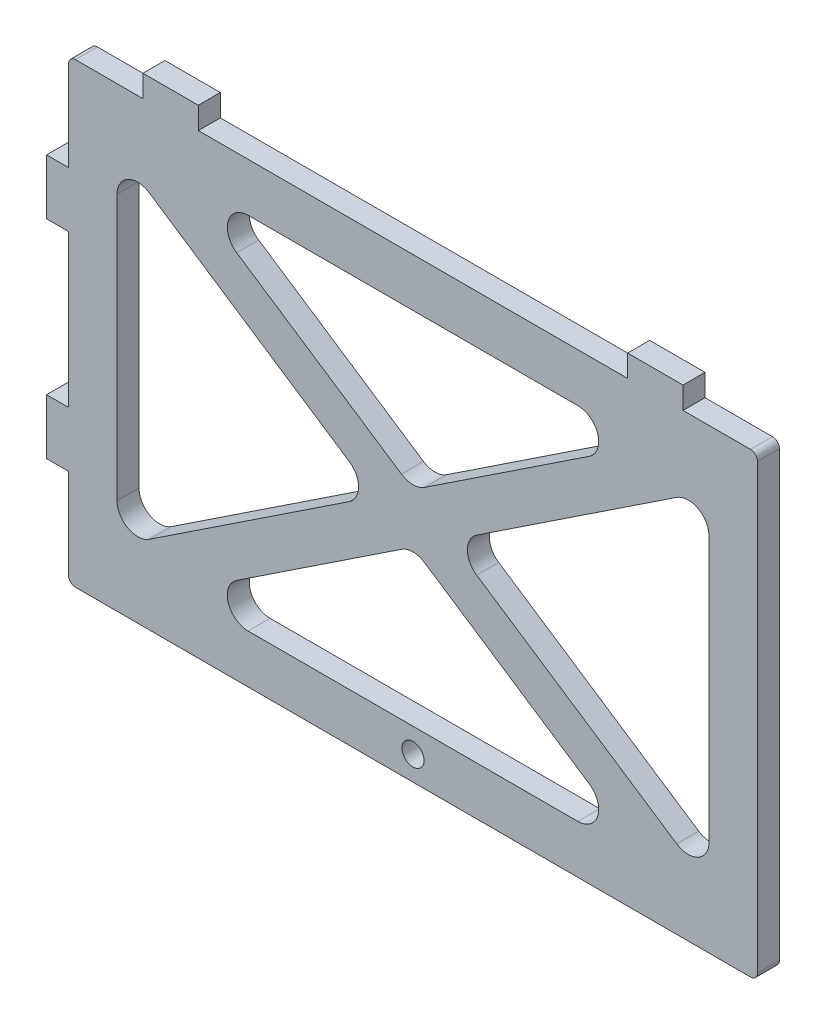
from build123d import *

# Parameters (mm, degrees)
SKETCH1_W                = 99.5
SKETCH1_H                = 66
BOSS_EXTRUDE1_DEPTH      = 3.175
CUT_EXTRUDE1_DEPTH       = 60.784137737
M3_CLEARANCE_HOLE1_D     = 3.2
M3_CLEARANCE_HOLE1_DEPTH = 12
M3_CLEARANCE_HOLE1_TIP   = 0.96137699
SKETCH6_W                = 3.175
SKETCH6_H                = 8
SKETCH6_W_2              = 8
SKETCH6_H_2              = 3.175
BOSS_EXTRUDE2_DEPTH      = 3.175
FILLET1_R                = 3
FILLET2_R                = 1


with BuildPart() as part:
    # Sketch1 → Boss-Extrude1 (new body)
    with BuildSketch(Plane.XY):
        Rectangle(SKETCH1_W, SKETCH1_H)
    extrude(amount=BOSS_EXTRUDE1_DEPTH)

    # Sketch2 → Cut-Extrude1 (cut, through all)
    with BuildSketch(Plane.XY.offset(3.175)):
        Polygon((-42.75, 24.756797808), (-5.427251789, 0), (-42.75, -24.756797808), align=None)
        Polygon((33.769717908, 26), (0, 3.599986111), (-33.769717908, 26), align=None)
        Polygon((42.75, 24.756797808), (5.427251789, 0), (42.75, -24.756797808), align=None)
        Polygon((-33.769717908, -26), (33.769717908, -26), (0, -3.599986111), align=None)
    extrude(amount=-CUT_EXTRUDE1_DEPTH, mode=Mode.SUBTRACT)

    # M3 Clearance Hole1
    with Locations(Plane.XY.offset(3.175)):
        with Locations((0, -29.5)):
            Hole(M3_CLEARANCE_HOLE1_D / 2, depth=M3_CLEARANCE_HOLE1_DEPTH)
            with Locations((0, 0, -(M3_CLEARANCE_HOLE1_DEPTH + M3_CLEARANCE_HOLE1_TIP / 2))):  # 118° drill point
                Cone(0, M3_CLEARANCE_HOLE1_D / 2, M3_CLEARANCE_HOLE1_TIP, mode=Mode.SUBTRACT)

    # Sketch6 → Boss-Extrude2 (add)
    with BuildSketch(Plane.XY.offset(3.175)):
        with Locations((-51.3375, 15)):
            Rectangle(SKETCH6_W, SKETCH6_H)
        with Locations((-51.3375, -15)):
            Rectangle(SKETCH6_W, SKETCH6_H)
        with Locations((-35, 34.5875)):
            Rectangle(SKETCH6_W_2, SKETCH6_H_2)
        with Locations((35, 34.5875)):
            Rectangle(SKETCH6_W_2, SKETCH6_H_2)
    extrude(amount=-BOSS_EXTRUDE2_DEPTH)

    # Fillet1
    fillet1_edges = [part.edges().sort_by_distance(p)[0] for p in [
        (42.75, 24.756797808, 1.5875),
        (42.75, -24.756797808, 1.5875),
        (5.427251789, 0, 1.5875),
        (-33.769717908, 26, 1.5875),
        (33.769717908, 26, 1.5875),
        (0, 3.599986111, 1.5875),
        (0, -3.599986111, 1.5875),
        (33.769717908, -26, 1.5875),
        (-33.769717908, -26, 1.5875),
        (-42.75, -24.756797808, 1.5875),
        (-42.75, 24.756797808, 1.5875),
        (-5.427251789, 0, 1.5875),
    ]]
    fillet(fillet1_edges, radius=FILLET1_R)

    # Fillet2
    fillet2_edges = [part.edges().sort_by_distance(p)[0] for p in [
        (49.75, -33, 1.5875),
        (-49.75, -33, 1.5875),
        (-49.75, 33, 1.5875),
        (49.75, 33, 1.5875),
    ]]
    fillet(fillet2_edges, radius=FILLET2_R)


solid = part.part
